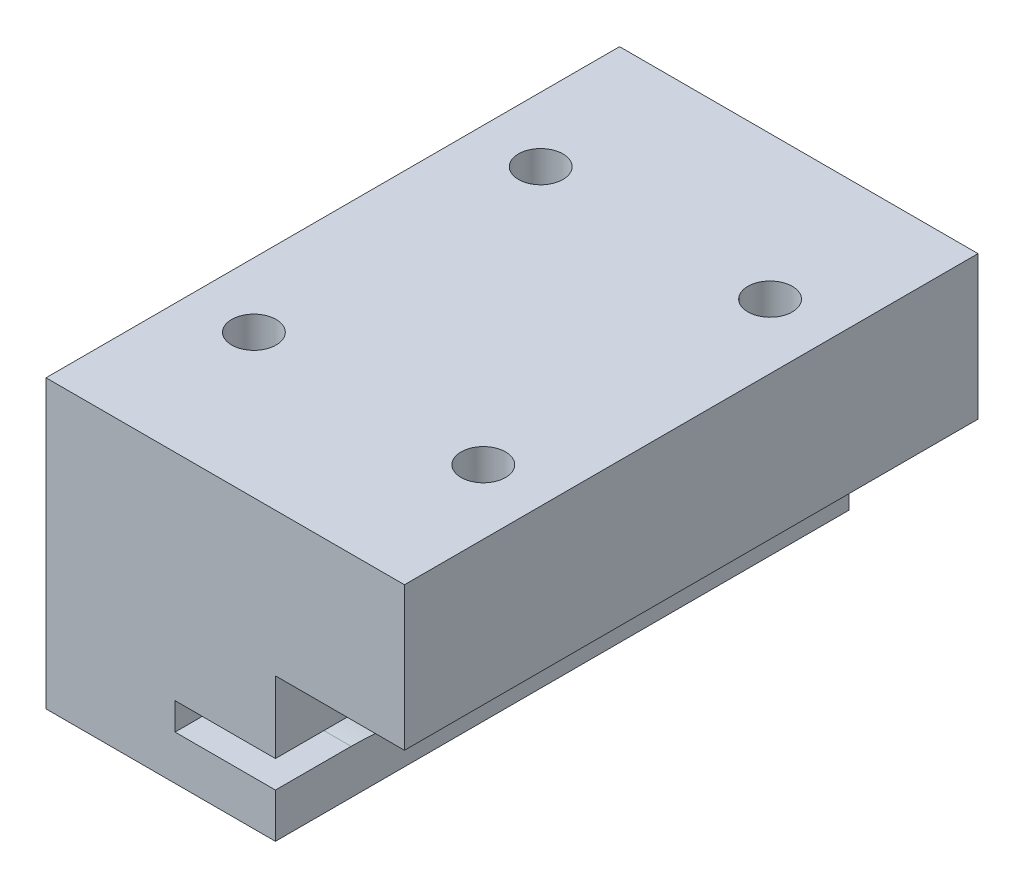
from build123d import *

# Parameters (mm, degrees)
BOSS_EXTRUDE1_DEPTH = 40
SKETCH2_R           = 1.55
CUT_EXTRUDE1_DEPTH  = 52.23475383
CUT_EXTRUDE2_DEPTH  = 7
SKETCH4_R           = 2.5
BOSS_EXTRUDE2_DEPTH = 7
CHAMFER1_SIZE       = 0.5
CUT_EXTRUDE3_DEPTH  = 5
CUT_EXTRUDE4_DEPTH  = 5


with BuildPart() as part:
    # Sketch1 → Boss-Extrude1 (new body)
    with BuildSketch(Plane.XY):
        Polygon((16, 0), (0, 0), (0, 20), (25, 20), (25, 10), (16, 10), align=None)
    extrude(amount=BOSS_EXTRUDE1_DEPTH)

    # Sketch2 → Cut-Extrude1 (cut, through all)
    with BuildSketch(Plane(origin=(0, 20, 0), x_dir=(1, 0, 0), z_dir=(0, 1, 0))):
        with Locations(Location((4.5, -10, 0), (0, 0, 270))):
            Circle(SKETCH2_R)
        with Locations(Location((20.5, -10, 0), (0, 0, 270))):
            Circle(SKETCH2_R)
        with Locations(Location((4.5, -30, 0), (0, 0, 270))):
            Circle(SKETCH2_R)
        with Locations(Location((20.5, -30, 0), (0, 0, 270))):
            Circle(SKETCH2_R)
    extrude(amount=-CUT_EXTRUDE1_DEPTH, mode=Mode.SUBTRACT)

    # Sketch3 → Cut-Extrude2 (cut)
    with BuildSketch(Plane(origin=(16, 0, 0), x_dir=(0, 0, -1), z_dir=(1, 0, 0))):
        with BuildLine():
            Line((-40, 5), (-34.186947262, 5))
            ThreePointArc((-34.186947262, 5), (-30.77376681, 5.710822798), (-27.928110681, 7.725099602))
            ThreePointArc((-27.928110681, 7.725099602), (-21.078030656, 5.78622927), (-26.65147843, 1.356839422))
            ThreePointArc((-26.65147843, 1.356839422), (-30.592126256, 2.659238759), (-34.718950561, 3.1))
            Line((-34.718950561, 3.1), (-40, 3.1))
            Line((-40, 3.1), (-40, 5))
        make_face()
        with BuildLine():
            Line((0, 5), (-5.813052738, 5))
            ThreePointArc((-5.813052738, 5), (-9.22623319, 5.710822798), (-12.071889319, 7.725099602))
            ThreePointArc((-12.071889319, 7.725099602), (-18.921969344, 5.78622927), (-13.34852157, 1.356839422))
            ThreePointArc((-13.34852157, 1.356839422), (-9.407873744, 2.659238759), (-5.281049439, 3.1))
            Line((-5.281049439, 3.1), (0, 3.1))
            Line((0, 3.1), (0, 5))
        make_face()
    extrude(amount=-CUT_EXTRUDE2_DEPTH, mode=Mode.SUBTRACT)

    # Sketch4 → Boss-Extrude2 (add)
    with BuildSketch(Plane(origin=(9, 0, 0), x_dir=(0, 0, -1), z_dir=(1, 0, 0))):
        with Locations((-25, 5)):
            Circle(SKETCH4_R)
        with Locations((-15, 5)):
            Circle(SKETCH4_R)
    extrude(amount=BOSS_EXTRUDE2_DEPTH)

    # Chamfer1
    chamfer1_edges = [part.edges().sort_by_distance(p)[0] for p in [
        (16, 5, 27.5),
        (16, 5, 17.5),
    ]]
    chamfer(chamfer1_edges, length=CHAMFER1_SIZE)

    # Sketch5 → Cut-Extrude3 (cut)
    with BuildSketch(Plane.XZ):
        Polygon((7.249630657, 11.5875), (4.5, 13.175), (1.750369343, 11.5875), (1.750369343, 8.4125), (4.5, 6.825), (7.249630657, 8.4125), align=None)
        Polygon((7.249630657, 31.5875), (4.5, 33.175), (1.750369343, 31.5875), (1.750369343, 28.4125), (4.5, 26.825), (7.249630657, 28.4125), align=None)
    extrude(amount=-CUT_EXTRUDE3_DEPTH, mode=Mode.SUBTRACT)

    # Sketch6 → Cut-Extrude4 (cut)
    with BuildSketch(Plane.XZ.offset(-10)):
        Polygon((23.249630657, 11.5875), (20.5, 13.175), (17.750369343, 11.5875), (17.750369343, 8.4125), (20.5, 6.825), (23.249630657, 8.4125), align=None)
        Polygon((23.249630657, 28.4125), (23.249630657, 31.5875), (20.5, 33.175), (17.750369343, 31.5875), (17.750369343, 28.4125), (20.5, 26.825), align=None)
    extrude(amount=-CUT_EXTRUDE4_DEPTH, mode=Mode.SUBTRACT)


solid = part.part
